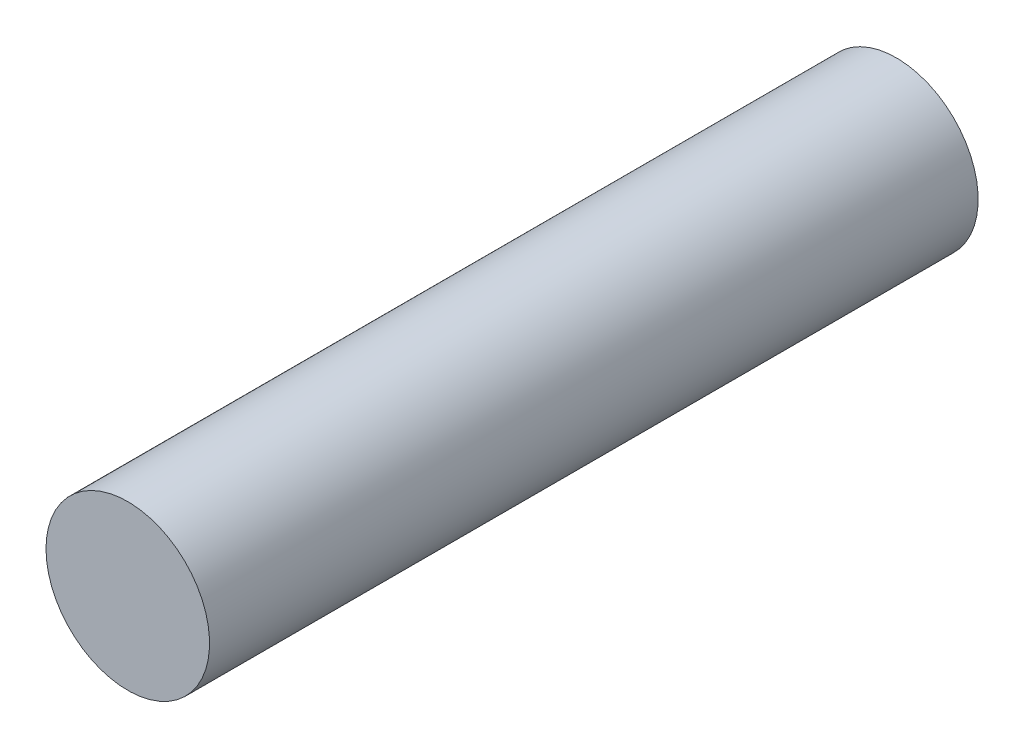
from build123d import *

# Parameters (mm, degrees)
SKETCH1_R           = 3.175
BOSS_EXTRUDE1_DEPTH = 29.845


with BuildPart() as part:
    # Sketch1 → Boss-Extrude1 (new body)
    with BuildSketch(Plane.XY):
        with Locations(Location((0, 0, 0), (0, 0, 180))):
            Circle(SKETCH1_R)
    extrude(amount=BOSS_EXTRUDE1_DEPTH)


solid = part.part
